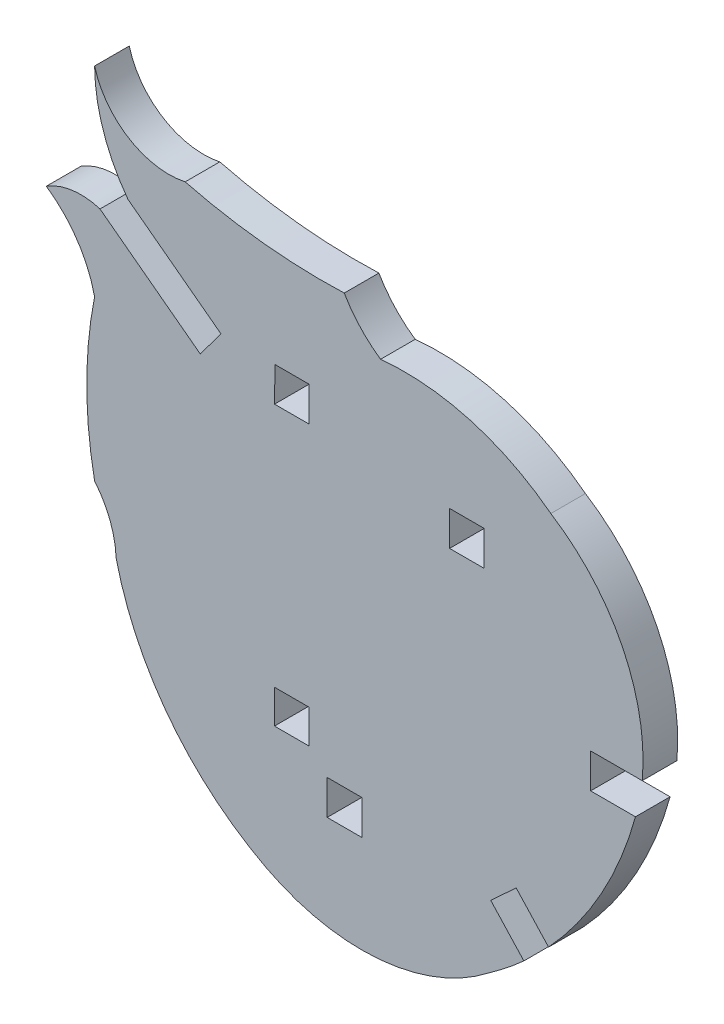
from build123d import *

# Parameters (mm, degrees)
SKETCH1_W           = 1.524
SKETCH1_H           = 1.481764771
SKETCH1_H_2         = 1.524
BOSS_EXTRUDE1_DEPTH = 1.524
SKETCH2_W           = 2.901164826
SKETCH2_H           = 1.524
CUT_EXTRUDE1_DEPTH  = 1.524


with BuildPart() as part:
    # Sketch1 → Boss-Extrude1 (new body)
    with BuildSketch(Plane.XY):
        with BuildLine():
            Line((-9.201867242, 66.283387572), (-4.791154517, 62.964734812))
            Line((-4.791154517, 62.964734812), (-3.874879328, 64.182526165))
            Line((-3.874879328, 64.182526165), (-7.967249174, 67.261655396))
            ThreePointArc((-7.967249174, 67.261655396), (-9.053535436, 69.319058784), (-9.439830642, 71.613334825))
            ThreePointArc((-9.439830642, 71.613334825), (-7.929515653, 69.608329431), (-5.454408435, 69.190068442))
            ThreePointArc((-5.454408435, 69.190068442), (-1.979913279, 68.569755109), (1.547610416, 68.453643912))
            ThreePointArc((1.547610416, 68.453643912), (2.250493371, 67.501534847), (3.14522315, 66.726928661))
            ThreePointArc((3.14522315, 66.726928661), (7.095824067, 66.377438321), (10.638674299, 64.594854987))
            ThreePointArc((10.638674299, 64.594854987), (13.932057854, 60.788978675), (14.582785292, 55.798224871))
            ThreePointArc((14.582785292, 55.798224871), (12.199808945, 50.134207473), (7.917480129, 45.72724375))
            ThreePointArc((7.917480129, 45.72724375), (3.14522315, 43.837178873), (-1.890077483, 44.833436601))
            ThreePointArc((-1.890077483, 44.833436601), (-6.113668677, 48.360365036), (-8.490380039, 53.323145493))
            ThreePointArc((-8.490380039, 53.323145493), (-8.760469415, 54.639184362), (-9.439830642, 55.798224871))
            ThreePointArc((-9.439830642, 55.798224871), (-9.784898441, 59.308308116), (-9.439830642, 62.818391362))
            ThreePointArc((-9.439830642, 62.818391362), (-10.203506988, 64.594854987), (-11.563650446, 65.969276447))
            ThreePointArc((-11.563650446, 65.969276447), (-10.417196882, 66.385269605), (-9.201867242, 66.283387572))
        make_face()
        Polygon((-1.502614608, 64.205247413), (0, 64.205247413), (0, 62.684788315), (-1.519736188, 62.684788315), align=None, mode=Mode.SUBTRACT)
        with Locations((-0.762, 51.153972349)):
            Rectangle(SKETCH1_W, SKETCH1_H, mode=Mode.SUBTRACT)
        with Locations((6.945775543, 61.8002372)):
            Rectangle(SKETCH1_W, SKETCH1_H_2, mode=Mode.SUBTRACT)
        with Locations((1.55818596, 48.853678484)):
            Rectangle(SKETCH1_W, SKETCH1_H_2, mode=Mode.SUBTRACT)
    extrude(amount=BOSS_EXTRUDE1_DEPTH)

    # Sketch2 → Cut-Extrude1 (cut)
    with BuildSketch(Plane.XY.offset(1.524)):
        Polygon((10.838910474, 47.694983966), (9.113748292, 49.563912383), (7.993907093, 48.530214319), (9.719069274, 46.661285901), align=None)
        with Locations((13.841078696, 55.662305548)):
            Rectangle(SKETCH2_W, SKETCH2_H)
    extrude(amount=-CUT_EXTRUDE1_DEPTH, mode=Mode.SUBTRACT)


solid = part.part
